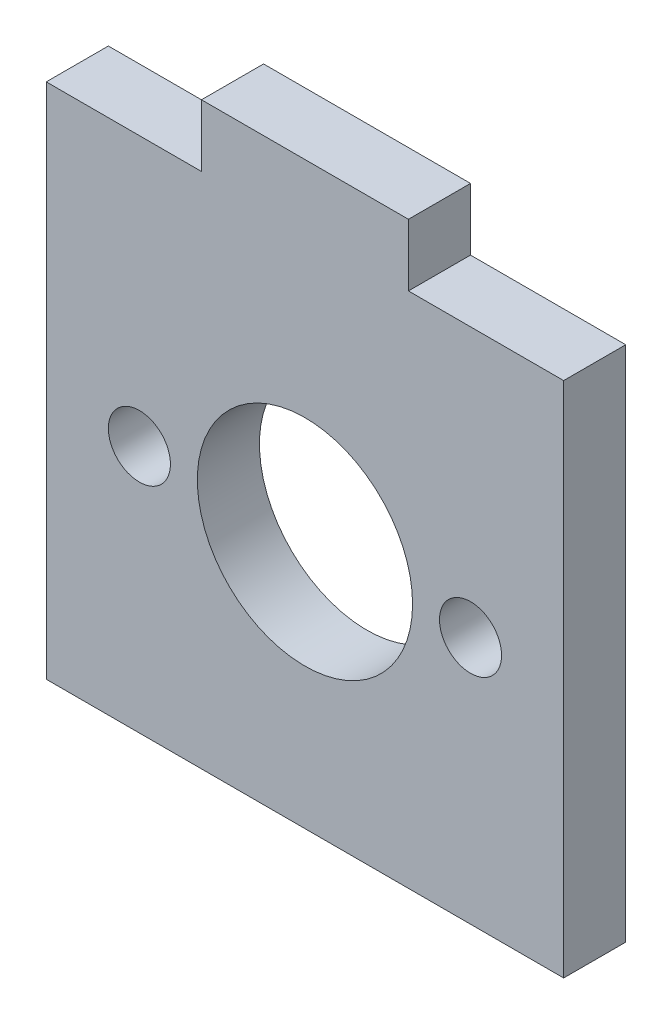
from build123d import *

# Parameters (mm, degrees)
SKETCH1_R           = 5.2
SKETCH1_R_2         = 1.5
BOSS_EXTRUDE1_DEPTH = 3


with BuildPart() as part:
    # Sketch1 → Boss-Extrude1 (new body)
    with BuildSketch(Plane.XY):
        Polygon((-12.5, 13), (-12.5, -12), (12.5, -12), (12.5, 13), (5, 13), (5, 16), (-5, 16), (-5, 13), align=None)
        Circle(SKETCH1_R, mode=Mode.SUBTRACT)
        with Locations((-8, 0)):
            Circle(SKETCH1_R_2, mode=Mode.SUBTRACT)
        with Locations((8, 0)):
            Circle(SKETCH1_R_2, mode=Mode.SUBTRACT)
    extrude(amount=BOSS_EXTRUDE1_DEPTH)


solid = part.part
